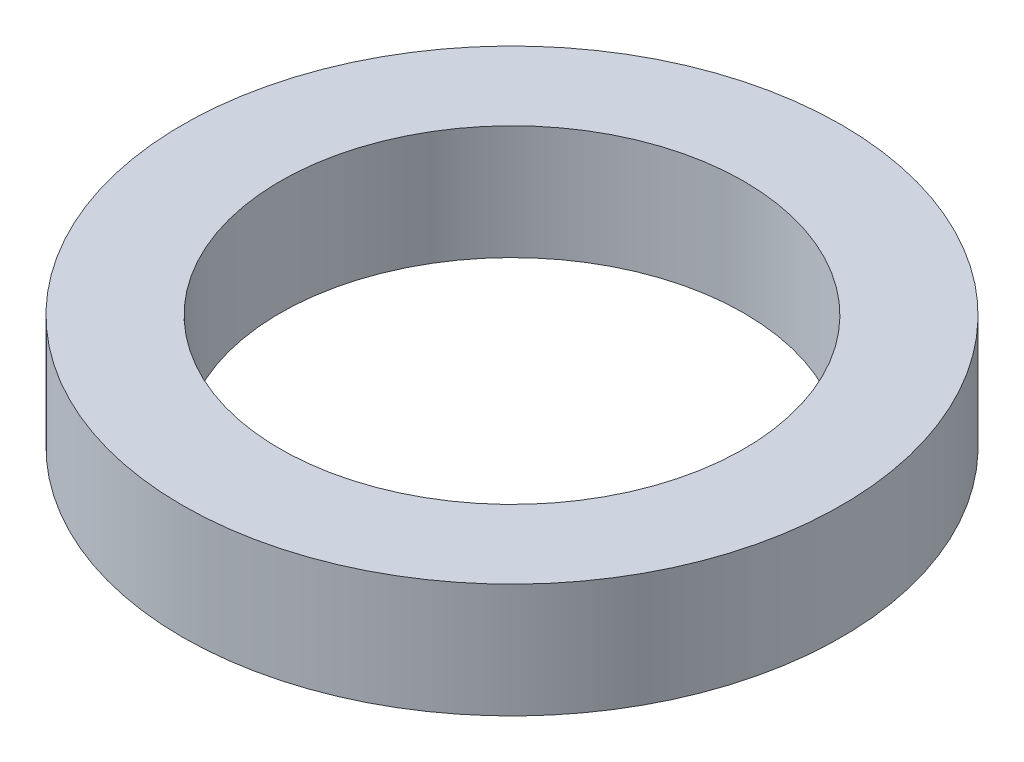
from build123d import *

# Parameters (mm, degrees)
SKETCH1_W = 1.369
SKETCH1_H = 1.6


with BuildPart() as part:
    # Sketch1 → Revolve1 (revolve)
    with BuildSketch(Plane.XY, mode=Mode.PRIVATE) as revolve1_sk:
        with Locations((3.9345, 3.3)):
            Rectangle(SKETCH1_W, SKETCH1_H)
    revolve(revolve1_sk.sketch.rotate(Axis((0, -200, 0), (0, 1, 0)), 90), axis=Axis((0, -200, 0), (0, 1, 0)))


solid = part.part
